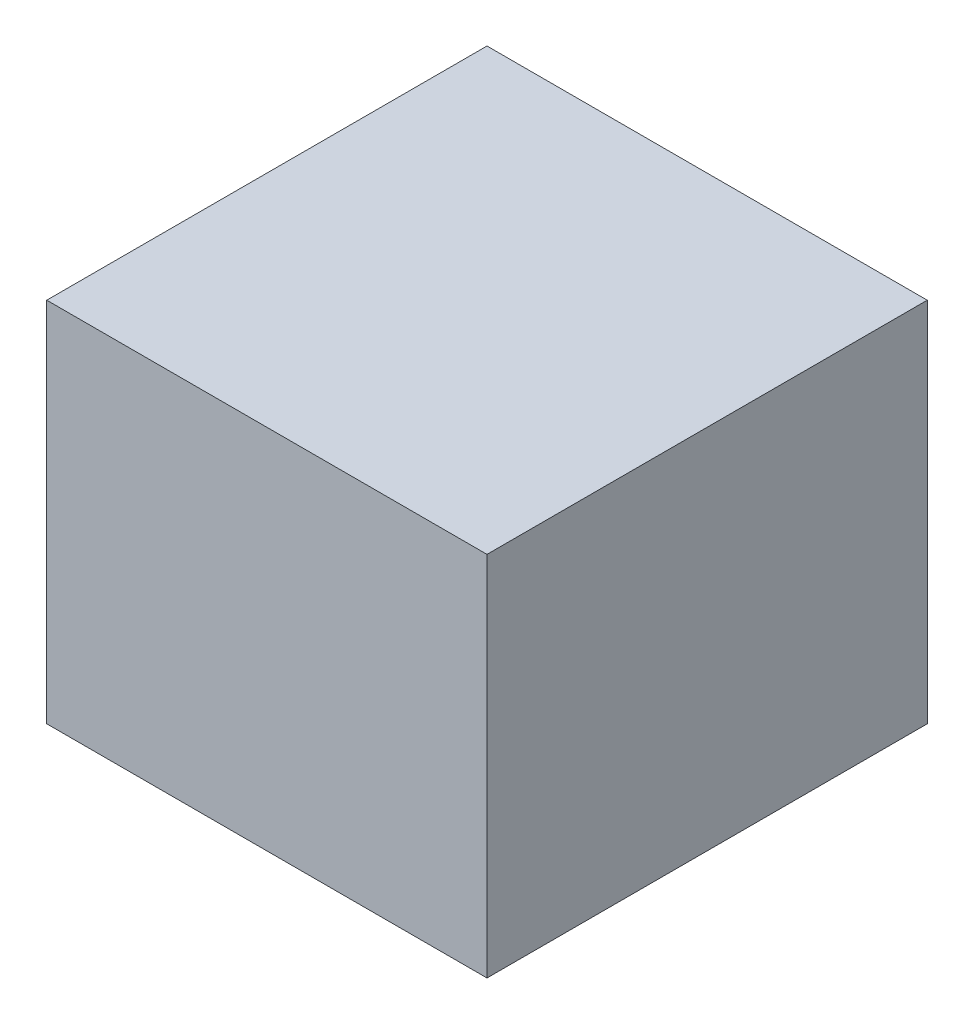
from build123d import *

# Parameters (mm, degrees)
SKETCH_1_W      = 96
SKETCH_1_H      = 96
EXTRUDE_1_DEPTH = 80


with BuildPart() as part:
    # Sketch 1 → Бобышка-Вытянуть1 (new body)
    with BuildSketch(Plane(origin=(0, 0, 0), x_dir=(1, 0, 0), z_dir=(0, 1, 0))):
        Rectangle(SKETCH_1_W, SKETCH_1_H)
    extrude(amount=-EXTRUDE_1_DEPTH)


solid = part.part
